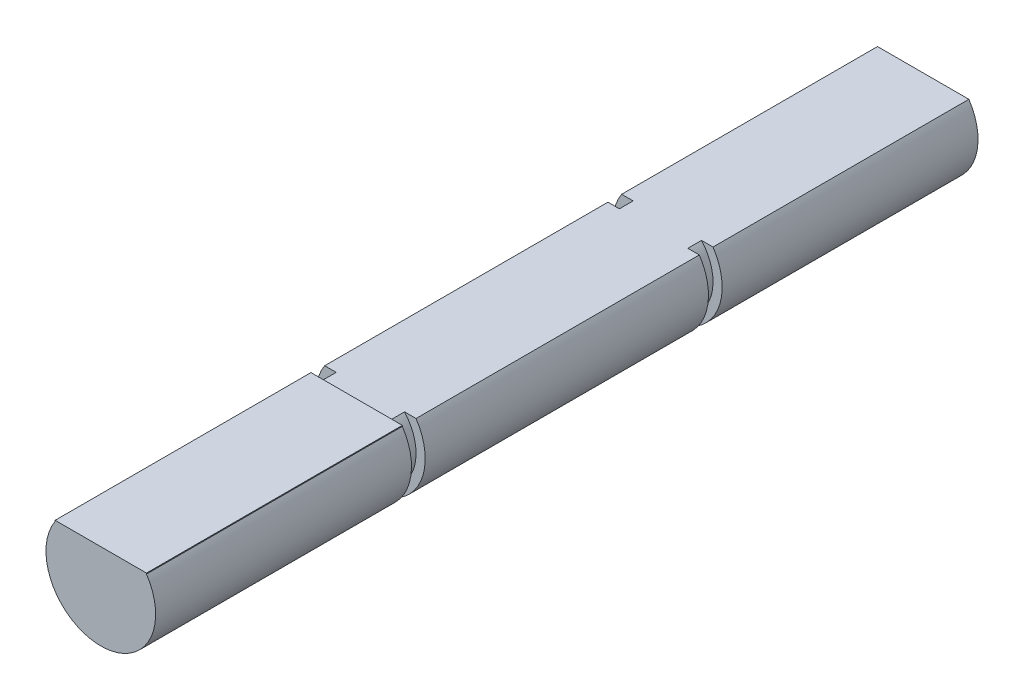
from build123d import *

# Parameters (mm, degrees)
EXTRUDE_1_DEPTH = 45
SKETCH_2_W      = 1
SKETCH_2_H      = 1.5
SKETCH_3_W      = 10
SKETCH_3_H      = 28
EXTRUDE_2_DEPTH = 0.1


with BuildPart() as part:
    # Эскиз1 → Бобышка-Вытянуть1 (new body)
    with BuildSketch(Plane.XY):
        with BuildLine():
            Line((-5, 3.31662479), (5, 3.31662479))
            ThreePointArc((5, 3.31662479), (0, -6), (-5, 3.31662479))
        make_face()
    extrude(amount=EXTRUDE_1_DEPTH)

    # Эскиз2 → Вырез-Повернуть1 (revolve, cut)
    with BuildSketch(Plane(origin=(0, 0, 0), x_dir=(1, 0, 0), z_dir=(0, 1, 0))):
        with Locations((5.5, -16.25)):
            Rectangle(SKETCH_2_W, SKETCH_2_H)
    revolve(axis=Axis((0, 0, 1000), (0, 0, -1)), mode=Mode.SUBTRACT)

    # Зеркальное отражение1: part across plane


with BuildPart() as part_1:
    add(part.part)
    add(part.part.mirror(Plane.XY))

    # Эскиз3 → Бобышка-Вытянуть2 (add)
    with BuildSketch(Plane(origin=(0, 3.31662479, 0), x_dir=(1, 0, 0), z_dir=(0, 1, 0))):
        with Locations((0, -31)):
            Rectangle(SKETCH_3_W, SKETCH_3_H)
    extrude(amount=EXTRUDE_2_DEPTH)


solid = part_1.part
